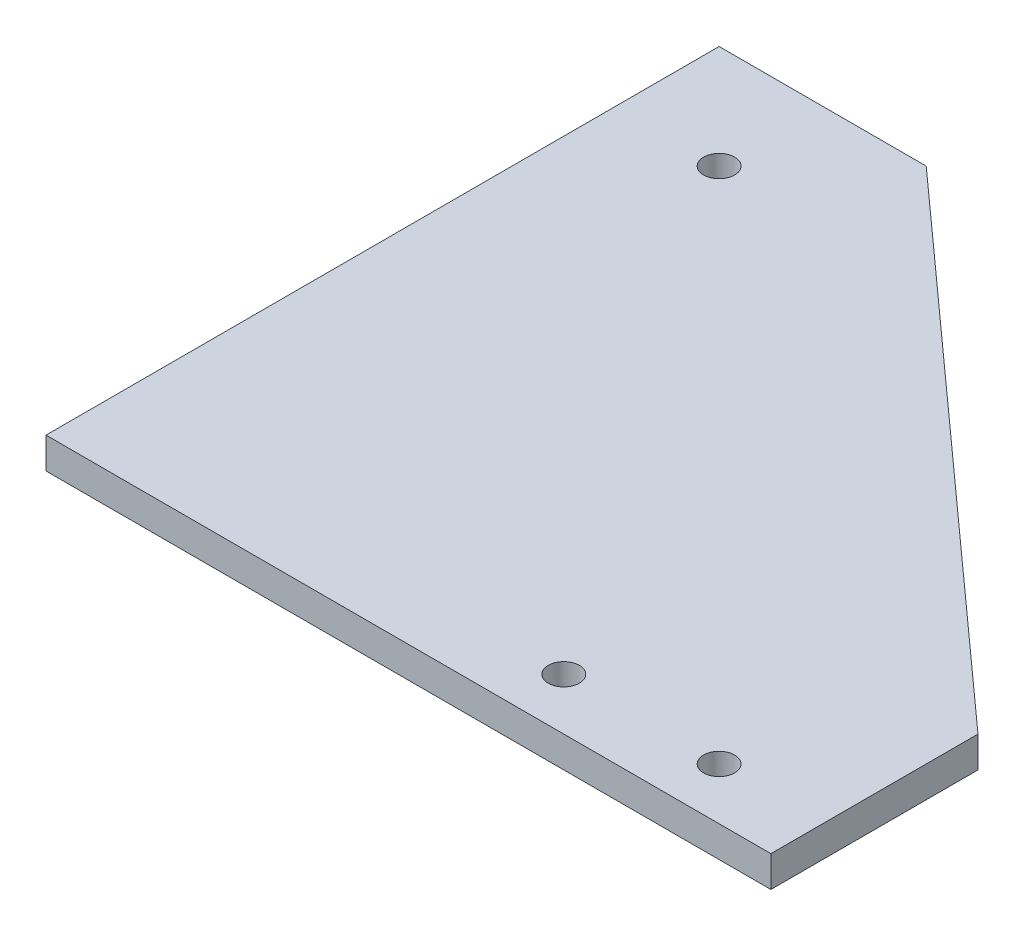
from build123d import *

# Parameters (mm, degrees)
SKETCH1_R           = 1.5
BOSS_EXTRUDE1_DEPTH = 3
SKETCH4_R           = 1.5
CUT_EXTRUDE1_DEPTH  = 5
SKETCH5_R           = 1.5
CUT_EXTRUDE2_DEPTH  = 49.645455777


with BuildPart() as part:
    # Sketch1 → Boss-Extrude1 (new body)
    with BuildSketch(Plane(origin=(0, 0, 0), x_dir=(1, 0, 0), z_dir=(0, 1, 0))):
        Polygon((35.579220967, -33.037848041), (-34.420779033, -33.037848041), (-34.420779033, 31.962151959), (-14.420779033, 31.962151959), (35.579220967, -13.037848041), align=None)
        with Locations(Location((25.579220967, -28.037848041, 0), (0, 0, 270))):
            Circle(SKETCH1_R, mode=Mode.SUBTRACT)
    extrude(amount=BOSS_EXTRUDE1_DEPTH)

    # Sketch4 → Cut-Extrude1 (cut)
    with BuildSketch(Plane(origin=(0, 3, 0), x_dir=(-1, 0, 0), z_dir=(0, 1, 0))):
        with Locations(Location((-10.579220967, 28.037848041, 0), (0, 0, 90))):
            Circle(SKETCH4_R)
    extrude(amount=-CUT_EXTRUDE1_DEPTH, mode=Mode.SUBTRACT)

    # Sketch5 → Cut-Extrude2 (cut, through all)
    with BuildSketch(Plane(origin=(0, 3, 0), x_dir=(-1, 0, 0), z_dir=(0, 1, 0))):
        with Locations(Location((24.420779033, -21.962151959, 0), (0, 0, 90))):
            Circle(SKETCH5_R)
    extrude(amount=-CUT_EXTRUDE2_DEPTH, mode=Mode.SUBTRACT)


solid = part.part
